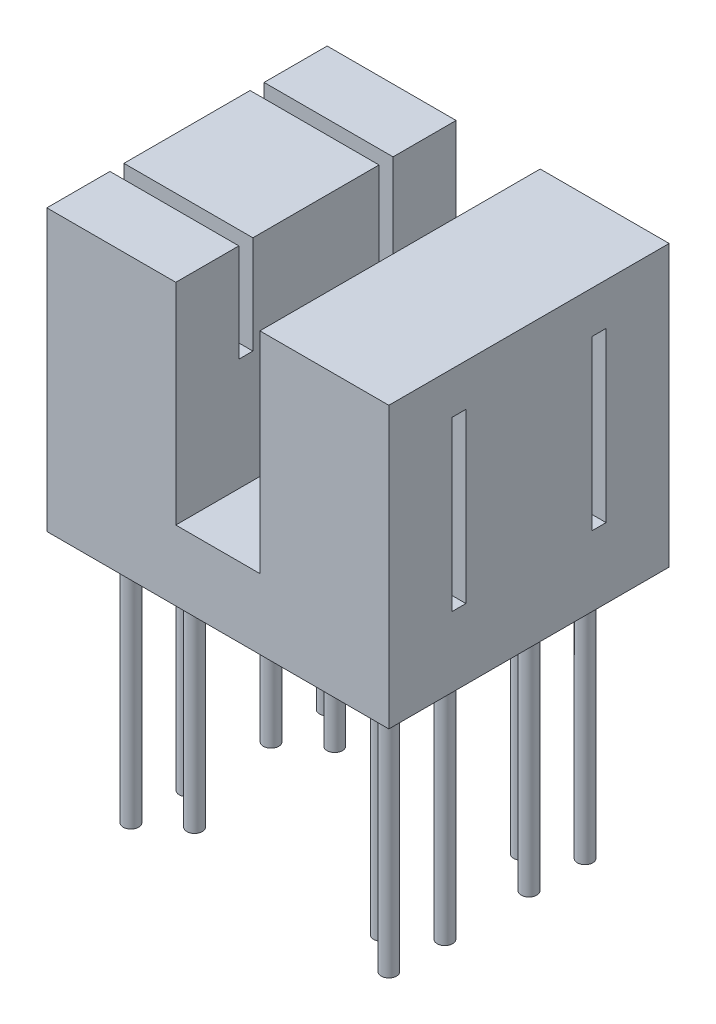
from build123d import *

# Parameters (mm, degrees)
SKETCH1_W               = 4.6
SKETCH1_H               = 5
BOSS_EXTRUDE1_DEPTH     = 7.5
BOSS_EXTRUDE1_2_DEPTH   = 7.5
SKETCH1_4_W             = 12.2
SKETCH1_4_H             = 5
BOSS_EXTRUDE2_DEPTH     = 2.5
SKETCH2_W               = 0.5
SKETCH2_H               = 3.5
CUT_EXTRUDE1_DEPTH      = 11.966312051
SKETCH3_W               = 0.5
SKETCH3_H               = 6
CUT_EXTRUDE2_DEPTH      = 11.966312051
SKETCH5_R               = 0.275
BOSS_EXTRUDE3_DEPTH     = 9
MIRROR1_COPY_1_SKETCH_R = 0.275
MIRROR1_COPY_1_DEPTH    = 9


with BuildPart() as part:
    # Sketch1 → Boss-Extrude1 (new body)
    with BuildSketch(Plane(origin=(0, 0, 0), x_dir=(1, 0, 0), z_dir=(0, 1, 0))):
        with Locations((-3.8, 0)):
            Rectangle(SKETCH1_W, SKETCH1_H)
    boss_extrude1 = extrude(amount=BOSS_EXTRUDE1_DEPTH)



with BuildPart() as body_2:
    # Sketch1 → Boss-Extrude1 2 (new body)
    with BuildSketch(Plane(origin=(0, 0, 0), x_dir=(1, 0, 0), z_dir=(0, 1, 0))):
        with Locations((3.8, 0)):
            Rectangle(SKETCH1_W, SKETCH1_H)
    boss_extrude1_2 = extrude(amount=BOSS_EXTRUDE1_2_DEPTH)


with BuildPart() as part_1:
    add(part.part)

    add(body_2.part)  # Boss-Extrude2 merges body 2
    # Sketch1<4> → Boss-Extrude2 (add)
    with BuildSketch(Plane(origin=(0, 0, 0), x_dir=(1, 0, 0), z_dir=(0, 1, 0))):
        Rectangle(SKETCH1_4_W, SKETCH1_4_H)
    boss_extrude2 = extrude(amount=-BOSS_EXTRUDE2_DEPTH)

    # Sketch2 → Cut-Extrude1 (cut, through all)
    with BuildSketch(Plane(origin=(-1.5, 0, 0), x_dir=(0, 0, -1), z_dir=(1, 0, 0))):
        with Locations((0, 5.75)):
            Rectangle(SKETCH2_W, SKETCH2_H)
    cut_extrude1 = extrude(amount=-CUT_EXTRUDE1_DEPTH, mode=Mode.SUBTRACT)

    # Sketch3 → Cut-Extrude2 (cut, through all)
    with BuildSketch(Plane.ZY.offset(-1.5)):
        with Locations((0, 3)):
            Rectangle(SKETCH3_W, SKETCH3_H)
    cut_extrude2 = extrude(amount=-CUT_EXTRUDE2_DEPTH, mode=Mode.SUBTRACT)

    # Sketch5 → Boss-Extrude3 (add)
    with BuildSketch(Plane(origin=(0, -2.5, 0), x_dir=(-1, 0, 0), z_dir=(0, -1, 0))):
        with Locations((4.6, -1)):
            Circle(SKETCH5_R)
        with Locations((4.6, 1)):
            Circle(SKETCH5_R)
        with Locations((3.33, 0)):
            Circle(SKETCH5_R)
    boss_extrude3 = extrude(amount=BOSS_EXTRUDE3_DEPTH)

    # Mirror2: Boss-Extrude3 across plane
    add(boss_extrude3.mirror(Plane(origin=(0, 0, 0), x_dir=(0, 0, 1), z_dir=(1, 0, 0))))

    # Mirror1: Boss-Extrude1, Boss-Extrude1 2, Boss-Extrude2, Cut-Extrude1, Cut-Extrude2, Boss-Extrude3 across plane
    add(boss_extrude1.mirror(Plane(origin=(0, 7.5, -2.5), x_dir=(1, 0, 0), z_dir=(0, 0, 1))))
    add(boss_extrude1_2.mirror(Plane(origin=(0, 7.5, -2.5), x_dir=(1, 0, 0), z_dir=(0, 0, 1))))
    add(boss_extrude2.mirror(Plane(origin=(0, 7.5, -2.5), x_dir=(1, 0, 0), z_dir=(0, 0, 1))))
    add(cut_extrude1.mirror(Plane(origin=(0, 7.5, -2.5), x_dir=(1, 0, 0), z_dir=(0, 0, 1))), mode=Mode.SUBTRACT)
    add(cut_extrude2.mirror(Plane(origin=(0, 7.5, -2.5), x_dir=(1, 0, 0), z_dir=(0, 0, 1))), mode=Mode.SUBTRACT)
    add(boss_extrude3.mirror(Plane(origin=(0, 7.5, -2.5), x_dir=(1, 0, 0), z_dir=(0, 0, 1))))

    # Mirror1 copy 1 sketch → Mirror1 copy 1 (add)
    with BuildSketch(Plane(origin=(0, -2.5, -5), x_dir=(1, 0, 0), z_dir=(0, -1, 0))):
        with Locations((4.6, -1)):
            Circle(MIRROR1_COPY_1_SKETCH_R)
        with Locations((4.6, 1)):
            Circle(MIRROR1_COPY_1_SKETCH_R)
        with Locations((3.33, 0)):
            Circle(MIRROR1_COPY_1_SKETCH_R)
    extrude(amount=MIRROR1_COPY_1_DEPTH)


solid = part_1.part
